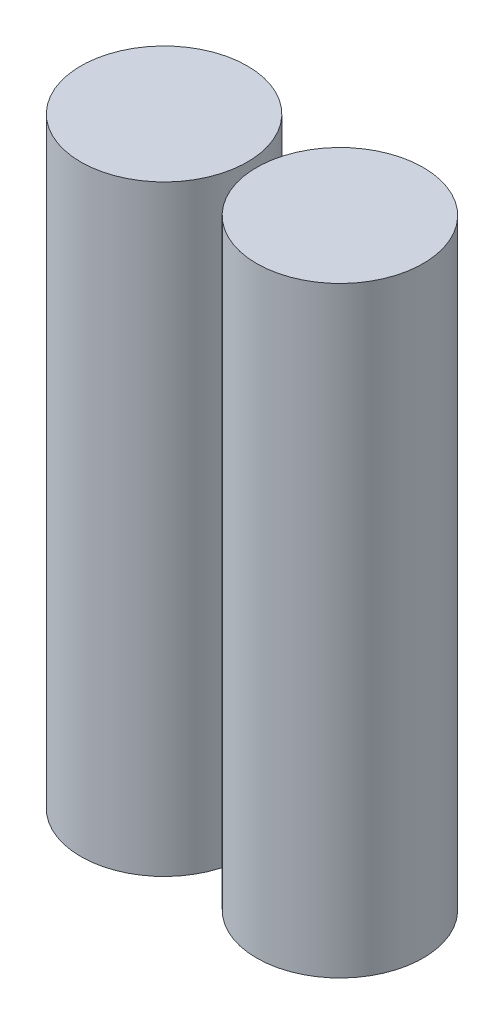
from build123d import *

# Parameters (mm, degrees)
SKETCH1_R             = 9
BOSS_EXTRUDE1_DEPTH   = 65
BOSS_EXTRUDE1_2_DEPTH = 65


with BuildPart() as part:
    # Sketch1 → Boss-Extrude1 (new body)
    with BuildSketch(Plane(origin=(0, 0, 0), x_dir=(1, 0, 0), z_dir=(0, 1, 0))):
        with Locations(Location((0, 0, 0), (0, 0, 270))):
            Circle(SKETCH1_R)
    extrude(amount=BOSS_EXTRUDE1_DEPTH)


with BuildPart() as body_2:
    # Sketch1 → Boss-Extrude1 2 (new body)
    with BuildSketch(Plane(origin=(0, 0, 0), x_dir=(1, 0, 0), z_dir=(0, 1, 0))):
        with Locations(Location((19, 0, 0), (0, 0, 270))):
            Circle(SKETCH1_R)
    extrude(amount=BOSS_EXTRUDE1_2_DEPTH)


solid = Compound([part.part, body_2.part])
